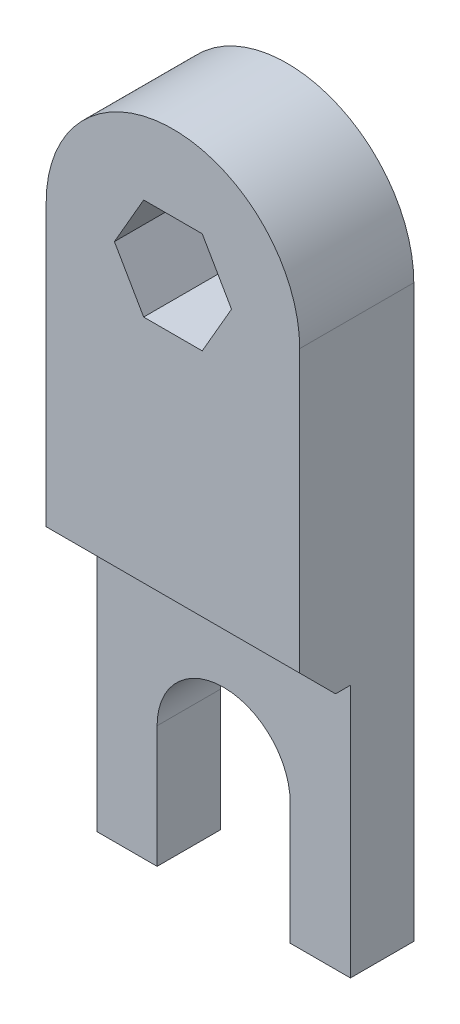
from build123d import *

# Parameters (mm, degrees)
BOSS_EXTRUDE1_DEPTH = 3.6
CHAMFER1_SIZE       = 1.131371061
CHAMFER1_SIZE2      = 1.131370771
BOSS_EXTRUDE2_DEPTH = 2


with BuildPart() as part:
    # Sketch1 → Boss-Extrude1 (new body)
    with BuildSketch(Plane(origin=(0, 0, 0), x_dir=(-1, 0, 0), z_dir=(0, 0, -1))):
        with BuildLine():
            Line((-4, 14), (-4, 4.000000018))
            Line((-4, 4.000000018), (4, 4.000000018))
            Line((4, 4.000000018), (4, 14))
            ThreePointArc((4, 14), (0, 18), (-4, 14))
        make_face()
        Polygon((-0.92376, 12.400000746), (-1.84752, 14), (-0.92376, 15.599999254), (0.92376, 15.599999254), (1.84752, 14), (0.92376, 12.400000746), align=None, mode=Mode.SUBTRACT)
    extrude(amount=-BOSS_EXTRUDE1_DEPTH)

    # Chamfer1
    chamfer1_edges = [part.edges().sort_by_distance(p)[0] for p in [
        (0, 4.000000018, 3.6),
    ]]
    chamfer1_side = [part.faces().sort_by_distance(p)[0] for p in [
        (0, 4.000000018, 1.8),
    ]]
    chamfer(chamfer1_edges, length=CHAMFER1_SIZE, length2=CHAMFER1_SIZE2, reference=chamfer1_side[0])

    # Sketch6 → Boss-Extrude2 (add)
    with BuildSketch(Plane(origin=(0, 0, 0), x_dir=(-1, 0, 0), z_dir=(0, 0, -1))):
        with BuildLine():
            Line((-4, -4), (-2.1, -4))
            Line((-2.1, -4), (-2.1, -0.156392755))
            ThreePointArc((-2.1, -0.156392755), (0, 1.943607245), (2.1, -0.156392755))
            Line((2.1, -0.156392755), (2.1, -4))
            Line((2.1, -4), (4, -4))
            Line((4, -4), (4, 4.000000018))
            Line((4, 4.000000018), (-4, 4.000000018))
            Line((-4, 4.000000018), (-4, -4))
        make_face()
    extrude(amount=-BOSS_EXTRUDE2_DEPTH)


solid = part.part
